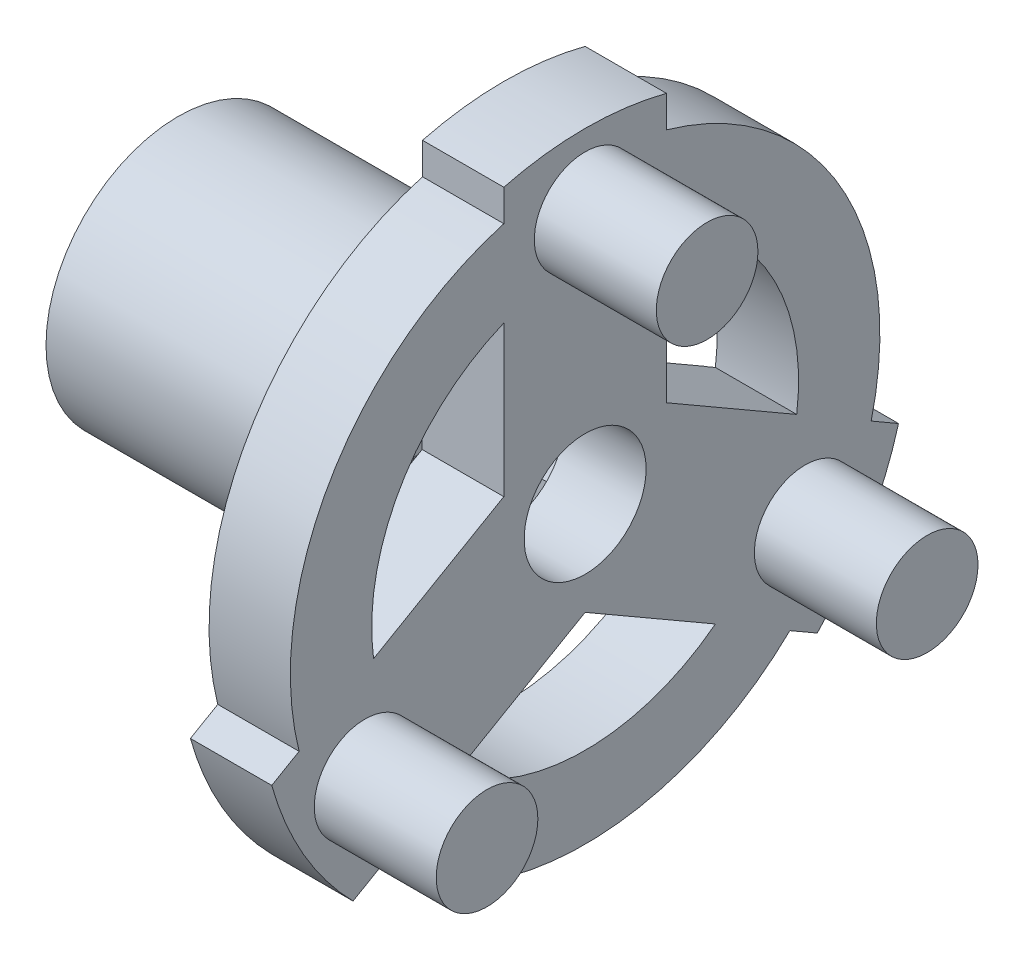
from build123d import *

# Parameters (mm, degrees)
SKETCH_1_R               = 8
EXTRUDE_1_DEPTH          = 2
EXTRUDE_START            = 2
SKETCH_1_3_R             = 1.25
EXTRUDE_2_DEPTH          = 3
SKETCH_2_R               = 5
SKETCH_2_R_2             = 1.5
EXTRUDE_3_DEPTH          = 0.01
SKETCH_3_R               = 3.25
SKETCH_3_R_2             = 2.45
EXTRUDE_4_DEPTH          = 8
CUT_EXTRUDE_1_DEPTH      = 14.862182368
CUT_EXTRUDE_1_DEPTH_BACK = 14.862182368
SKETCH_2_2_R             = 1.5
CUT_EXTRUDE_2_REACH      = 17.106


with BuildPart() as part:
    # 草图1 → 凸台-拉伸1 (new body)
    with BuildSketch(Plane(origin=(0, 0, 0), x_dir=(0, 0, -1), z_dir=(1, 0, 0))):
        Circle(SKETCH_1_R)
    extrude(amount=EXTRUDE_1_DEPTH)

    # 草图1<3> → 凸台-拉伸2 (add)
    with BuildSketch(Plane(origin=(0, 0, 0), x_dir=(0, 0, -1), z_dir=(1, 0, 0)).offset(EXTRUDE_START)):
        with Locations((0, 6.25)):
            Circle(SKETCH_1_3_R)
        with Locations((-5.412658774, -3.125)):
            Circle(SKETCH_1_3_R)
        with Locations((5.412658774, -3.125)):
            Circle(SKETCH_1_3_R)
    extrude(amount=EXTRUDE_2_DEPTH)

    # 草图2 → 凸台-拉伸3 (add)
    with BuildSketch(Plane.ZY):
        with Locations(Location((0, 0, 0), (0, 0, 180))):
            Circle(SKETCH_2_R)
        with Locations(Location((0, 0, 0), (0, 0, 180))):
            Circle(SKETCH_2_R_2, mode=Mode.SUBTRACT)
    extrude(amount=EXTRUDE_3_DEPTH)

    # 草图3 → 凸台-拉伸4 (add)
    # profile 1 of 5: a face of its own
    with BuildSketch(Plane.ZY.offset(0.01)):
        Circle(SKETCH_3_R)
        Circle(SKETCH_3_R_2, mode=Mode.SUBTRACT)
    # profile 2 of 5: a face of its own
    with BuildSketch(Plane.ZY.offset(0.01)):
        with BuildLine():
            ThreePointArc((-1.092787266, 2.192787266), (-1.732411614, 1.732411614), (-2.192787266, 1.092787266))
            Line((-2.192787266, 1.092787266), (-1.092787266, 1.092787266))
            Line((-1.092787266, 1.092787266), (-1.092787266, 2.192787266))
        make_face()
    # profile 3 of 5: a face of its own
    with BuildSketch(Plane.ZY.offset(0.01)):
        with BuildLine():
            Line((-1.092787266, -1.092787266), (-2.192787266, -1.092787266))
            ThreePointArc((-2.192787266, -1.092787266), (-1.732411614, -1.732411614), (-1.092787266, -2.192787266))
            Line((-1.092787266, -2.192787266), (-1.092787266, -1.092787266))
        make_face()
    # profile 4 of 5: a face of its own
    with BuildSketch(Plane.ZY.offset(0.01)):
        with BuildLine():
            Line((2.192787266, -1.092787266), (1.092787266, -1.092787266))
            Line((1.092787266, -1.092787266), (1.092787266, -2.192787266))
            ThreePointArc((1.092787266, -2.192787266), (1.732411614, -1.732411614), (2.192787266, -1.092787266))
        make_face()
    # profile 5 of 5: a face of its own
    with BuildSketch(Plane.ZY.offset(0.01)):
        with BuildLine():
            Line((1.092787266, 2.192787266), (1.092787266, 1.092787266))
            Line((1.092787266, 1.092787266), (2.192787266, 1.092787266))
            ThreePointArc((2.192787266, 1.092787266), (1.732411614, 1.732411614), (1.092787266, 2.192787266))
        make_face()
    extrude(amount=EXTRUDE_4_DEPTH)

    # 草图2<2> → 切除-拉伸1 (cut, two sides: drawn at the far end of the back side and taken through both)
    with BuildSketch(Plane.ZY.offset(-CUT_EXTRUDE_1_DEPTH_BACK)):
        with Locations(Location((0, 0, 0), (0, 0, 180))):
            Circle(SKETCH_2_2_R)
    extrude(amount=CUT_EXTRUDE_1_DEPTH + CUT_EXTRUDE_1_DEPTH_BACK, mode=Mode.SUBTRACT)

    # 切除-拉伸2: up to this face of the body (flat: up to its plane)
    cut_extrude_2_end = Plane(part.part.faces().sort_by_distance((-0.01, 0, 4.858578644))[0])
    # 草图4 → 切除-拉伸2 (cut, up to the picked face)
    with BuildSketch(Plane(origin=(2, 0, 0), x_dir=(0, 0, -1), z_dir=(1, 0, 0)), mode=Mode.PRIVATE) as cut_extrude_2_sk1:
        with BuildLine():
            Line((-2, 1.154700538), (-2, 4.85412196))
            ThreePointArc((-2, 4.85412196), (-4.54663337, 2.625), (-5.20379293, -0.695010172))
            Line((-5.20379293, -0.695010172), (-2, 1.154700538))
        make_face()
    cut_extrude_2_tool1 = split(extrude(cut_extrude_2_sk1.sketch, amount=-CUT_EXTRUDE_2_REACH, mode=Mode.PRIVATE), bisect_by=cut_extrude_2_end, keep=Keep.BOTH, mode=Mode.PRIVATE)
    # 草图4 → 切除-拉伸2 (cut, up to the picked face)
    with BuildSketch(Plane(origin=(2, 0, 0), x_dir=(0, 0, -1), z_dir=(1, 0, 0)), mode=Mode.PRIVATE) as cut_extrude_2_sk2:
        with BuildLine():
            Line((2, 1.154700538), (5.20379293, -0.695010172))
            ThreePointArc((5.20379293, -0.695010172), (5.238435496, -0.348272247), (5.25, 0))
            ThreePointArc((5.25, 0), (4.362482092, 2.920830361), (2, 4.85412196))
            Line((2, 4.85412196), (2, 1.154700538))
        make_face()
    cut_extrude_2_tool2 = split(extrude(cut_extrude_2_sk2.sketch, amount=-CUT_EXTRUDE_2_REACH, mode=Mode.PRIVATE), bisect_by=cut_extrude_2_end, keep=Keep.BOTH, mode=Mode.PRIVATE)
    # 草图4 → 切除-拉伸2 (cut, up to the picked face)
    with BuildSketch(Plane(origin=(2, 0, 0), x_dir=(0, 0, -1), z_dir=(1, 0, 0)), mode=Mode.PRIVATE) as cut_extrude_2_sk3:
        with BuildLine():
            ThreePointArc((-3.20379293, -4.159111787), (0, -5.25), (3.20379293, -4.159111787))
            Line((3.20379293, -4.159111787), (0, -2.309401077))
            Line((0, -2.309401077), (-3.20379293, -4.159111787))
        make_face()
    cut_extrude_2_tool3 = split(extrude(cut_extrude_2_sk3.sketch, amount=-CUT_EXTRUDE_2_REACH, mode=Mode.PRIVATE), bisect_by=cut_extrude_2_end, keep=Keep.BOTH, mode=Mode.PRIVATE)
    # 草图4 → 切除-拉伸2 (cut, up to the picked face)
    with BuildSketch(Plane(origin=(2, 0, 0), x_dir=(0, 0, -1), z_dir=(1, 0, 0)), mode=Mode.PRIVATE) as cut_extrude_2_sk4:
        with BuildLine():
            ThreePointArc((-2, 7.745966692), (-6.92820323, 4), (-7.708203932, -2.140932539))
            Line((-7.708203932, -2.140932539), (-7.035053852, -1.752289159))
            ThreePointArc((-7.035053852, -1.752289159), (-6.278684177, 3.625), (-2, 6.968679932))
            Line((-2, 6.968679932), (-2, 7.745966692))
        make_face()
    cut_extrude_2_tool4 = split(extrude(cut_extrude_2_sk4.sketch, amount=-CUT_EXTRUDE_2_REACH, mode=Mode.PRIVATE), bisect_by=cut_extrude_2_end, keep=Keep.BOTH, mode=Mode.PRIVATE)
    # 草图4 → 切除-拉伸2 (cut, up to the picked face)
    with BuildSketch(Plane(origin=(2, 0, 0), x_dir=(0, 0, -1), z_dir=(1, 0, 0)), mode=Mode.PRIVATE) as cut_extrude_2_sk5:
        with BuildLine():
            Line((7.035053852, -1.752289159), (7.708203932, -2.140932539))
            ThreePointArc((7.708203932, -2.140932539), (7.926715318, -1.080363027), (8, 0))
            ThreePointArc((8, 0), (6.32455532, 4.898979486), (2, 7.745966692))
            Line((2, 7.745966692), (2, 6.968679932))
            ThreePointArc((2, 6.968679932), (5.790617411, 4.362482092), (7.25, 0))
            ThreePointArc((7.25, 0), (7.196062827, -0.882711609), (7.035053852, -1.752289159))
        make_face()
    cut_extrude_2_tool5 = split(extrude(cut_extrude_2_sk5.sketch, amount=-CUT_EXTRUDE_2_REACH, mode=Mode.PRIVATE), bisect_by=cut_extrude_2_end, keep=Keep.BOTH, mode=Mode.PRIVATE)
    # 草图4 → 切除-拉伸2 (cut, up to the picked face)
    with BuildSketch(Plane(origin=(2, 0, 0), x_dir=(0, 0, -1), z_dir=(1, 0, 0)), mode=Mode.PRIVATE) as cut_extrude_2_sk6:
        with BuildLine():
            ThreePointArc((-5.708203932, -5.605034154), (0, -8), (5.708203932, -5.605034154))
            Line((5.708203932, -5.605034154), (5.035053852, -5.216390774))
            ThreePointArc((5.035053852, -5.216390774), (0, -7.25), (-5.035053852, -5.216390774))
            Line((-5.035053852, -5.216390774), (-5.708203932, -5.605034154))
        make_face()
    cut_extrude_2_tool6 = split(extrude(cut_extrude_2_sk6.sketch, amount=-CUT_EXTRUDE_2_REACH, mode=Mode.PRIVATE), bisect_by=cut_extrude_2_end, keep=Keep.BOTH, mode=Mode.PRIVATE)
    add(cut_extrude_2_tool1.solids().sort_by(Axis((2, 2.006872, 3.476004), (-1, 0, 0)))[0], mode=Mode.SUBTRACT)
    add(cut_extrude_2_tool2.solids().sort_by(Axis((2, 2.006872, -3.476004), (-1, 0, 0)))[0], mode=Mode.SUBTRACT)
    add(cut_extrude_2_tool3.solids().sort_by(Axis((2, -4.013743, 0), (-1, 0, 0)))[0], mode=Mode.SUBTRACT)
    add(cut_extrude_2_tool4.solids().sort_by(Axis((2, 7.357323, 2.115651), (-1, 0, 0)))[0], mode=Mode.SUBTRACT)
    add(cut_extrude_2_tool5.solids().sort_by(Axis((2, -1.846454, -7.429454), (-1, 0, 0)))[0], mode=Mode.SUBTRACT)
    add(cut_extrude_2_tool6.solids().sort_by(Axis((2, -7.367509, 0), (-1, 0, 0)))[0], mode=Mode.SUBTRACT)


solid = part.part
